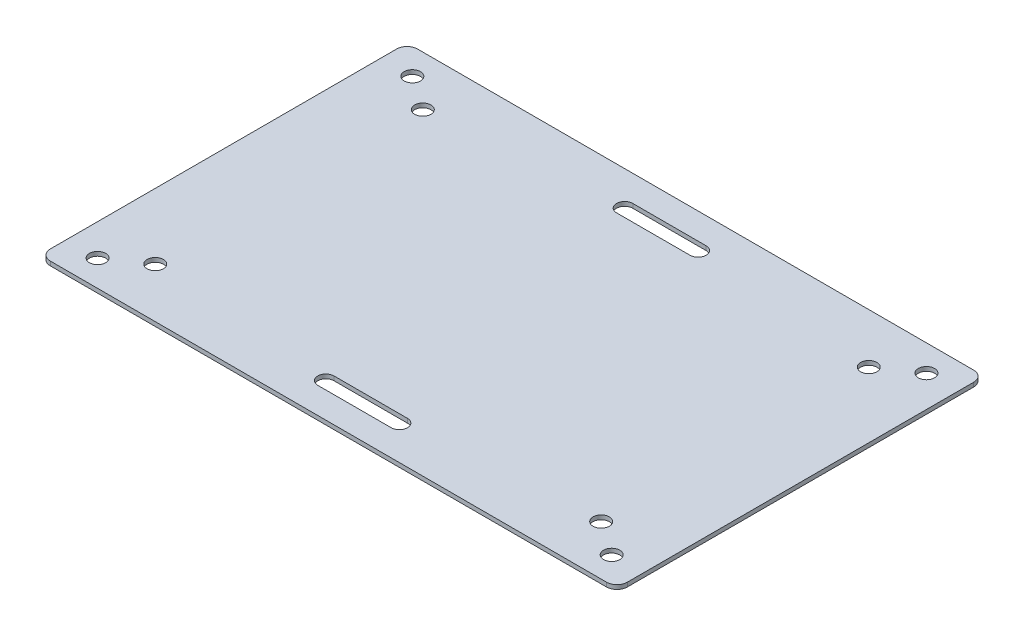
from build123d import *

# Parameters (mm, degrees)
SKETCH_1_W      = 110
SKETCH_1_H      = 70
SKETCH_1_R      = 1.55
EXTRUDE_1_DEPTH = 0.8
FILLET_1_R      = 2
FILLET_2_R      = 2
FILLET_3_R      = 2
FILLET_4_R      = 2


with BuildPart() as part:
    # 草图1 → 凸台-拉伸1 (new body)
    with BuildSketch(Plane(origin=(0, 0, 0), x_dir=(1, 0, 0), z_dir=(0, 1, 0))):
        Rectangle(SKETCH_1_W, SKETCH_1_H)
        with Locations(Location((-49, 30, 0), (0, 0, 270))):
            Circle(SKETCH_1_R, mode=Mode.SUBTRACT)
        with Locations(Location((49, 30, 0), (0, 0, 90))):
            Circle(SKETCH_1_R, mode=Mode.SUBTRACT)
        with Locations(Location((49, -30, 0), (0, 0, 270))):
            Circle(SKETCH_1_R, mode=Mode.SUBTRACT)
        with Locations(Location((-49, -30, 0), (0, 0, 90))):
            Circle(SKETCH_1_R, mode=Mode.SUBTRACT)
        with Locations(Location((-42.5, 25.5, 0), (0, 0, 270))):
            Circle(SKETCH_1_R, mode=Mode.SUBTRACT)
        with Locations(Location((42.5, 25.5, 0), (0, 0, 90))):
            Circle(SKETCH_1_R, mode=Mode.SUBTRACT)
        with Locations(Location((42.5, -25.5, 0), (0, 0, 270))):
            Circle(SKETCH_1_R, mode=Mode.SUBTRACT)
        with Locations(Location((-42.5, -25.5, 0), (0, 0, 90))):
            Circle(SKETCH_1_R, mode=Mode.SUBTRACT)
        with BuildLine():
            Line((-7, 30.023350274), (7, 30.023350274))
            ThreePointArc((7, 30.023350274), (8.55, 28.473350274), (7, 26.923350274))
            Line((7, 26.923350274), (-7, 26.923350274))
            ThreePointArc((-7, 26.923350274), (-8.55, 28.473350274), (-7, 30.023350274))
        make_face(mode=Mode.SUBTRACT)
        with BuildLine():
            Line((7, -26.923350274), (-7, -26.923350274))
            ThreePointArc((-7, -26.923350274), (-8.55, -28.473350274), (-7, -30.023350274))
            Line((-7, -30.023350274), (7, -30.023350274))
            ThreePointArc((7, -30.023350274), (8.55, -28.473350274), (7, -26.923350274))
        make_face(mode=Mode.SUBTRACT)
    extrude(amount=EXTRUDE_1_DEPTH)

    # 圆角1
    fillet_1_edges = [part.edges().sort_by_distance(p)[0] for p in [
        (55, 0.4, -35),
    ]]
    fillet(fillet_1_edges, radius=FILLET_1_R)

    # 圆角2
    fillet_2_edges = [part.edges().sort_by_distance(p)[0] for p in [
        (-55, 0.4, -35),
    ]]
    fillet(fillet_2_edges, radius=FILLET_2_R)

    # 圆角3
    fillet_3_edges = [part.edges().sort_by_distance(p)[0] for p in [
        (-55, 0.4, 35),
    ]]
    fillet(fillet_3_edges, radius=FILLET_3_R)

    # 圆角4
    fillet_4_edges = [part.edges().sort_by_distance(p)[0] for p in [
        (55, 0.4, 35),
    ]]
    fillet(fillet_4_edges, radius=FILLET_4_R)


solid = part.part
